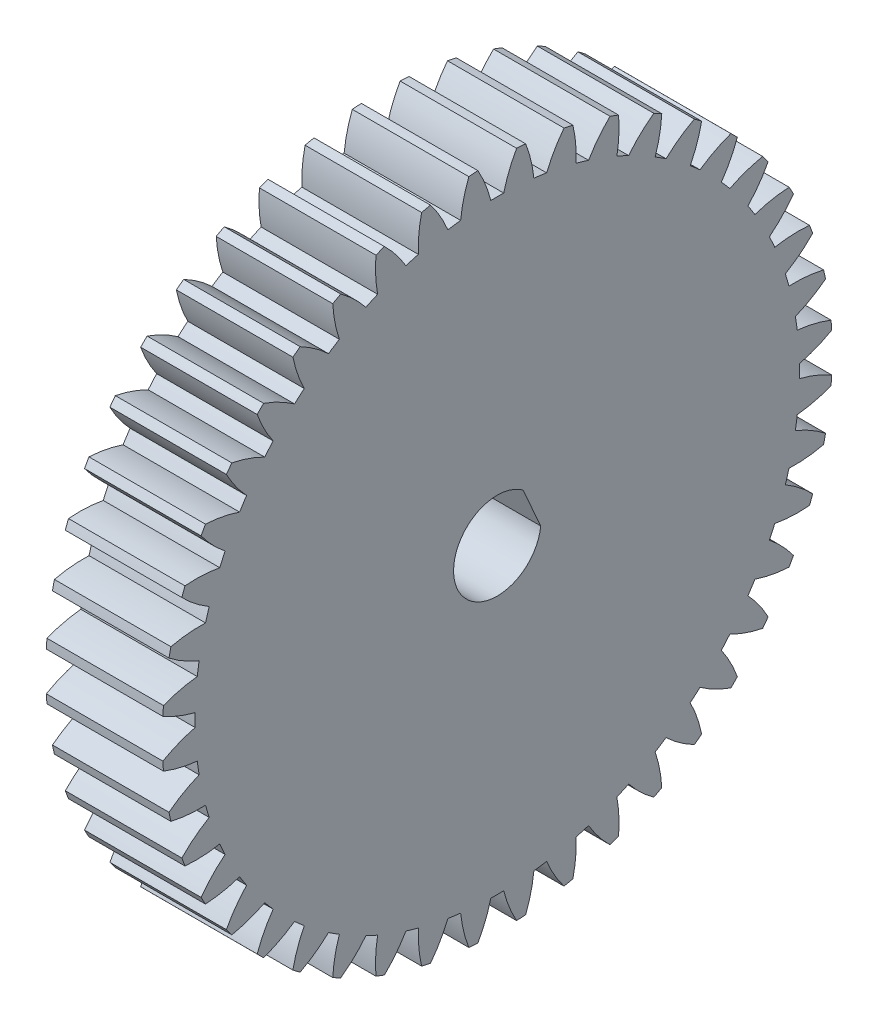
from build123d import *

# Parameters (mm, degrees)
BASPROSKE_W         = 4
BASPROSKE_H         = 11.5
TOOTHCUT_DEPTH      = 17.748134224
TEETHCUTS_COUNT     = 44
HUBNEAONESKE_R      = 2.5
HUBNEARONE_DEPTH    = 3.5000508
BORSKE_R            = 1.5
BORE_DEPTH          = 7.5000508
BOSS_EXTRUDE1_DEPTH = 7.5


with BuildPart() as part:
    # BasProSke → Base-Revolve (revolve)
    with BuildSketch(Plane(origin=(0, 0, 0), x_dir=(1, 0, 0), z_dir=(0, 1, 0)), mode=Mode.PRIVATE) as base_revolve_sk:
        with Locations((2, 5.75)):
            Rectangle(BASPROSKE_W, BASPROSKE_H)
    revolve(base_revolve_sk.sketch.rotate(Axis((-10, 0, 0), (1, 0, 0)), 180), axis=Axis((-10, 0, 0), (1, 0, 0)))

    # TooCutSke → ToothCut (cut, through all)
    with BuildSketch(Plane(origin=(0, 0, 0), x_dir=(0, 0, -1), z_dir=(1, 0, 0))):
        with BuildLine():
            ThreePointArc((0.221729116, 10.371630161), (0, 10.374), (-0.221729116, 10.371630161))
            ThreePointArc((-0.221729116, 10.371630161), (-0.410633561, 10.954460987), (-0.678666239, 11.505401223))
            ThreePointArc((-0.678666239, 11.505401223), (0, 11.5254), (0.678666239, 11.505401223))
            ThreePointArc((0.678666239, 11.505401223), (0.410633561, 10.954460987), (0.221729116, 10.371630161))
        make_face()
    toothcut = extrude(amount=TOOTHCUT_DEPTH, mode=Mode.SUBTRACT)

    # TeethCuts: ToothCut ×44 about axis
    teethcuts_axis = Axis((0, 0, 0), (1, 0, 0))
    for i in range(1, TEETHCUTS_COUNT):
        add(toothcut.rotate(teethcuts_axis, i * 360 / TEETHCUTS_COUNT), mode=Mode.SUBTRACT)

    # HubNeaOneSke → HubNearOne (add)
    with BuildSketch(Plane.ZY):
        with Locations(Location((0, 0, 0), (0, 0, 180))):
            Circle(HUBNEAONESKE_R)
    extrude(amount=HUBNEARONE_DEPTH)

    # BorSke → Bore (cut, symmetric)
    with BuildSketch(Plane(origin=(0, 0, 0), x_dir=(0, 0, -1), z_dir=(1, 0, 0))):
        with Locations(Location((0, 0, 0), (0, 0, 180))):
            Circle(BORSKE_R)
    extrude(amount=BORE_DEPTH, both=True, mode=Mode.SUBTRACT)

    # Sketch1 → Boss-Extrude1 (add)
    with BuildSketch(Plane(origin=(4, 0, 0), x_dir=(0, 0, -1), z_dir=(1, 0, 0))):
        with BuildLine():
            Line((0.884478096, 1.21148607), (1.491416761, -0.160237465))
            ThreePointArc((1.491416761, -0.160237465), (1.371723535, 0.606938665), (0.884478096, 1.21148607))
        make_face()
    extrude(amount=-BOSS_EXTRUDE1_DEPTH)


solid = part.part
